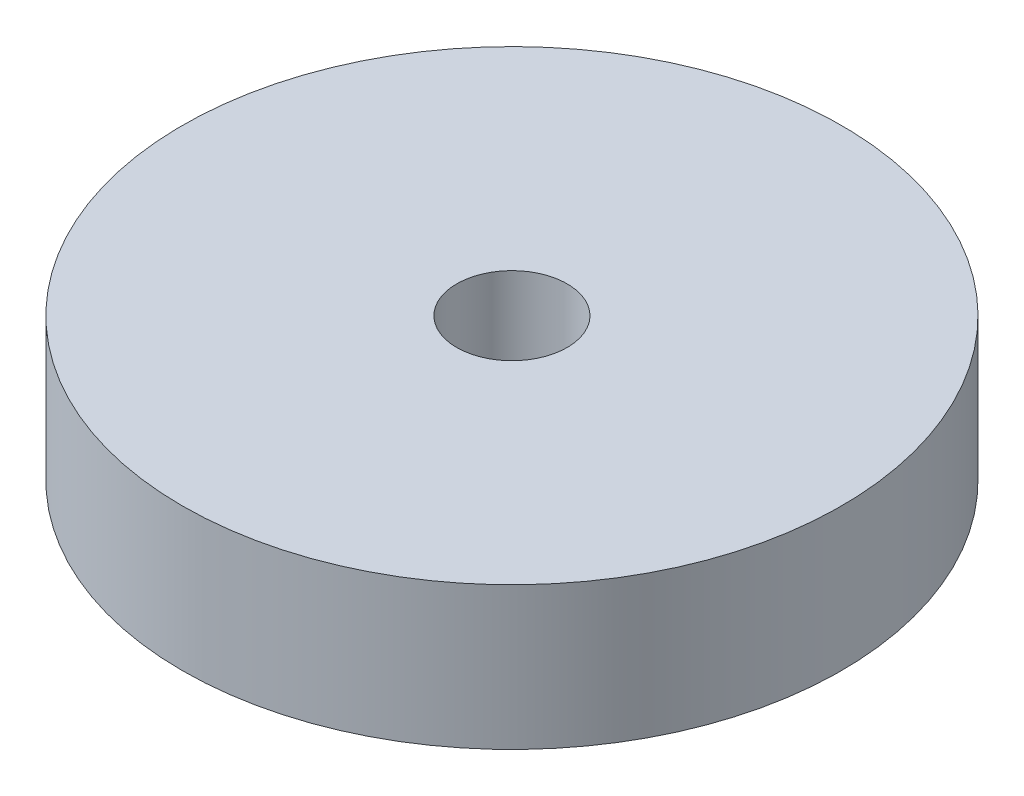
from build123d import *

# Parameters (mm, degrees)
SKETCH1_W                    = 14.6685
SKETCH1_H                    = 6.35
F_10_0_1935_DIAMETER_HOLE1_D = 4.9149


with BuildPart() as part:
    # Sketch1 → Revolve1 (revolve)
    with BuildSketch(Plane.XY, mode=Mode.PRIVATE) as revolve1_sk:
        with Locations((7.33425, 3.175)):
            Rectangle(SKETCH1_W, SKETCH1_H)
    revolve(revolve1_sk.sketch.rotate(Axis((0, 93.76022735, 0), (0, -1, 0)), 90), axis=Axis((0, 93.76022735, 0), (0, -1, 0)))

    # #10 (0.1935) Diameter Hole1 (through all)
    with Locations(Plane(origin=(0, 6.35, 0), x_dir=(1, 0, 0), z_dir=(0, 1, 0))):
        with Locations((0, 0)):
            Hole(F_10_0_1935_DIAMETER_HOLE1_D / 2)


solid = part.part
